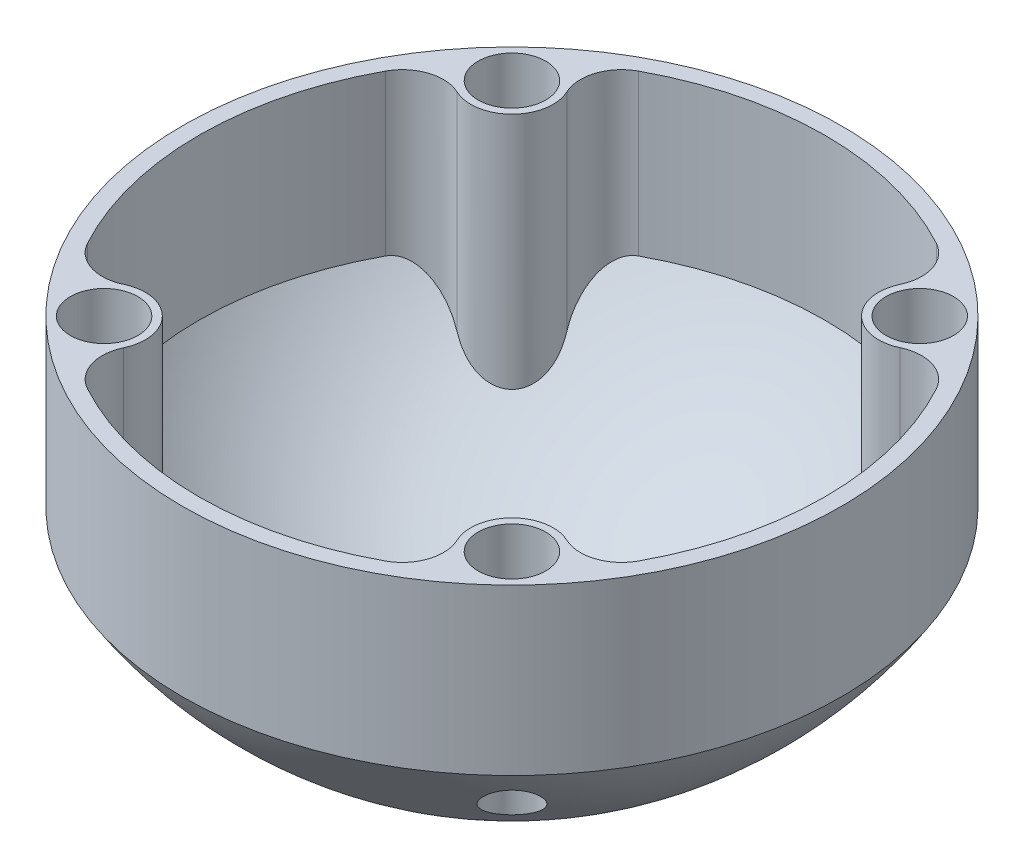
from build123d import *

# Parameters (mm, degrees)
SHELL1_T            = -2
BOSS_EXTRUDE1_REACH = 73.548
FILLET1_R           = 5
SKETCH11_R          = 4.1
CUT_EXTRUDE1_DEPTH  = 10
CUT_EXTRUDE3_START  = 25
SKETCH13_R          = 3
CUT_EXTRUDE3_DEPTH  = 23
SKETCH10_R          = 1.6
CUT_EXTRUDE4_DEPTH  = 19


with BuildPart() as part:
    # Sketch8 → Revolve1 (revolve)
    with BuildSketch(Plane.XY, mode=Mode.PRIVATE) as revolve1_sk:
        with BuildLine():
            Line((-40, 60), (0, 60))
            Line((0, 60), (0, 16.191880772))
            ThreePointArc((0, 16.191880772), (-22.86136678, 23.273202284), (-40, 39.978125413))
            Line((-40, 39.978125413), (-40, 60))
        make_face()
    revolve(revolve1_sk.sketch.rotate(Axis((0, 60, 0), (0, -1, 0)), 270), axis=Axis((0, 60, 0), (0, -1, 0)))

    # Shell1
    shell1_openings = [part.faces().sort_by_distance(p)[0] for p in [
        (0, 60, 0),
    ]]
    offset(amount=SHELL1_T, openings=shell1_openings, kind=Kind.INTERSECTION)

    # Sketch9 → Boss-Extrude1 (add, up to next)
    with BuildSketch(Plane(origin=(0, 60, 0), x_dir=(1, 0, 0), z_dir=(0, 1, 0)), mode=Mode.PRIVATE) as boss_extrude1_sk1:
        with BuildLine():
            ThreePointArc((-23.765714835, -29.651151721), (-21.213203436, -21.213203436), (-29.651151721, -23.765714835))
            ThreePointArc((-29.651151721, -23.765714835), (-26.870057685, -26.870057685), (-23.765714835, -29.651151721))
        make_face()
    boss_extrude1_tool1 = extrude(boss_extrude1_sk1.sketch, amount=-BOSS_EXTRUDE1_REACH, mode=Mode.PRIVATE) - part.part
    # Sketch9 → Boss-Extrude1 (add, up to next)
    with BuildSketch(Plane(origin=(0, 60, 0), x_dir=(1, 0, 0), z_dir=(0, 1, 0)), mode=Mode.PRIVATE) as boss_extrude1_sk2:
        with BuildLine():
            ThreePointArc((-29.651151721, 23.765714835), (-21.213203436, 21.213203436), (-23.765714835, 29.651151721))
            ThreePointArc((-23.765714835, 29.651151721), (-26.870057685, 26.870057685), (-29.651151721, 23.765714835))
        make_face()
    boss_extrude1_tool2 = extrude(boss_extrude1_sk2.sketch, amount=-BOSS_EXTRUDE1_REACH, mode=Mode.PRIVATE) - part.part
    # Sketch9 → Boss-Extrude1 (add, up to next)
    with BuildSketch(Plane(origin=(0, 60, 0), x_dir=(1, 0, 0), z_dir=(0, 1, 0)), mode=Mode.PRIVATE) as boss_extrude1_sk3:
        with BuildLine():
            ThreePointArc((23.765714835, 29.651151721), (21.213203436, 21.213203436), (29.651151721, 23.765714835))
            ThreePointArc((29.651151721, 23.765714835), (26.870057685, 26.870057685), (23.765714835, 29.651151721))
        make_face()
    boss_extrude1_tool3 = extrude(boss_extrude1_sk3.sketch, amount=-BOSS_EXTRUDE1_REACH, mode=Mode.PRIVATE) - part.part
    # Sketch9 → Boss-Extrude1 (add, up to next)
    with BuildSketch(Plane(origin=(0, 60, 0), x_dir=(1, 0, 0), z_dir=(0, 1, 0)), mode=Mode.PRIVATE) as boss_extrude1_sk4:
        with BuildLine():
            ThreePointArc((29.651151721, -23.765714835), (21.213203436, -21.213203436), (23.765714835, -29.651151721))
            ThreePointArc((23.765714835, -29.651151721), (26.870057685, -26.870057685), (29.651151721, -23.765714835))
        make_face()
    boss_extrude1_tool4 = extrude(boss_extrude1_sk4.sketch, amount=-BOSS_EXTRUDE1_REACH, mode=Mode.PRIVATE) - part.part
    add(boss_extrude1_tool1.solids().sort_by_distance((-24.278279, 60, 24.278279))[0])
    add(boss_extrude1_tool2.solids().sort_by_distance((-24.278279, 60, -24.278279))[0])
    add(boss_extrude1_tool3.solids().sort_by_distance((24.278279, 60, -24.278279))[0])
    add(boss_extrude1_tool4.solids().sort_by_distance((24.278279, 60, 24.278279))[0])

    # Fillet1
    fillet1_edges = [part.edges().sort_by_distance(p)[0] for p in [
        (29.651151721, 50.280882833, 23.765714835),
        (23.765714835, 50.280882833, 29.651151721),
        (23.765714835, 50.280882833, -29.651151721),
        (29.651151721, 50.280882833, -23.765714835),
        (-29.651151721, 50.280882833, -23.765714835),
        (-23.765714835, 50.280882833, -29.651151721),
        (-23.765714835, 50.280882833, 29.651151721),
        (-29.651151721, 50.280882833, 23.765714835),
    ]]
    fillet(fillet1_edges, radius=FILLET1_R)

    # Sketch11 → Cut-Extrude1 (cut)
    with BuildSketch(Plane(origin=(0, 60, 0), x_dir=(1, 0, 0), z_dir=(0, 1, 0))):
        with Locations(Location((-24.748737342, 24.748737342, 0), (0, 0, 270))):
            Circle(SKETCH11_R)
        with Locations(Location((24.748737342, 24.748737342, 0), (0, 0, 270))):
            Circle(SKETCH11_R)
        with Locations(Location((24.748737342, -24.748737342, 0), (0, 0, 270))):
            Circle(SKETCH11_R)
        with Locations(Location((-24.748737342, -24.748737342, 0), (0, 0, 270))):
            Circle(SKETCH11_R)
    extrude(amount=-CUT_EXTRUDE1_DEPTH, mode=Mode.SUBTRACT)

    # Sketch13 → Cut-Extrude3 (cut)
    with BuildSketch(Plane(origin=(0, 0, 0), x_dir=(1, 0, 0), z_dir=(0, 1, 0)).offset(CUT_EXTRUDE3_START)):
        with Locations(Location((-24.748737342, 24.748737342, 0), (0, 0, 237.612850238))):
            Circle(SKETCH13_R)
        with Locations(Location((24.748737342, 24.748737342, 0), (0, 0, 158.126965759))):
            Circle(SKETCH13_R)
        with Locations(Location((24.748737342, -24.748737342, 0), (0, 0, 135))):
            Circle(SKETCH13_R)
        with Locations(Location((-24.748737342, -24.748737342, 0), (0, 0, 117.176017048))):
            Circle(SKETCH13_R)
    extrude(amount=CUT_EXTRUDE3_DEPTH, mode=Mode.SUBTRACT)

    # Sketch10 → Cut-Extrude4 (cut)
    with BuildSketch(Plane(origin=(0, 60, 0), x_dir=(1, 0, 0), z_dir=(0, 1, 0))):
        with Locations(Location((-24.748737342, -24.748737342, 0), (0, 0, 270))):
            Circle(SKETCH10_R)
        with Locations(Location((-24.748737342, 24.748737342, 0), (0, 0, 270))):
            Circle(SKETCH10_R)
        with Locations(Location((24.748737342, 24.748737342, 0), (0, 0, 270))):
            Circle(SKETCH10_R)
        with Locations(Location((24.748737342, -24.748737342, 0), (0, 0, 270))):
            Circle(SKETCH10_R)
    extrude(amount=-CUT_EXTRUDE4_DEPTH, mode=Mode.SUBTRACT)


solid = part.part
